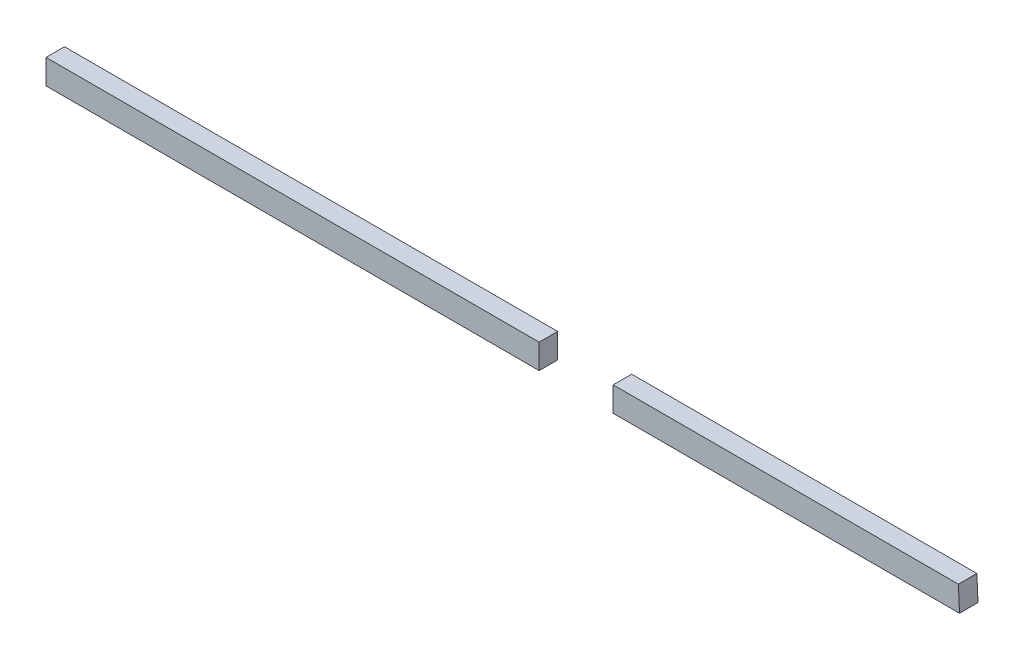
from build123d import *

# Parameters (mm, degrees)
SKETCH1_W             = 40
SKETCH1_H             = 2
BOSS_EXTRUDE1_DEPTH   = 1.5
BOSS_EXTRUDE1_2_DEPTH = 1.5


with BuildPart() as part:
    # Sketch1 → Boss-Extrude1 (new body)
    with BuildSketch(Plane.XY):
        with Locations((-57.544619595, 9.204483614)):
            Rectangle(SKETCH1_W, SKETCH1_H)
    extrude(amount=-BOSS_EXTRUDE1_DEPTH)


with BuildPart() as body_2:
    # Sketch1 → Boss-Extrude1 2 (new body)
    with BuildSketch(Plane.XY):
        Polygon((-31.544619595, 10.204483614), (-31.544619595, 8.204483614), (-3.454836204, 8.204483614), (-3.544619595, 10.204483614), align=None)
    extrude(amount=-BOSS_EXTRUDE1_2_DEPTH)


solid = Compound([part.part, body_2.part])
